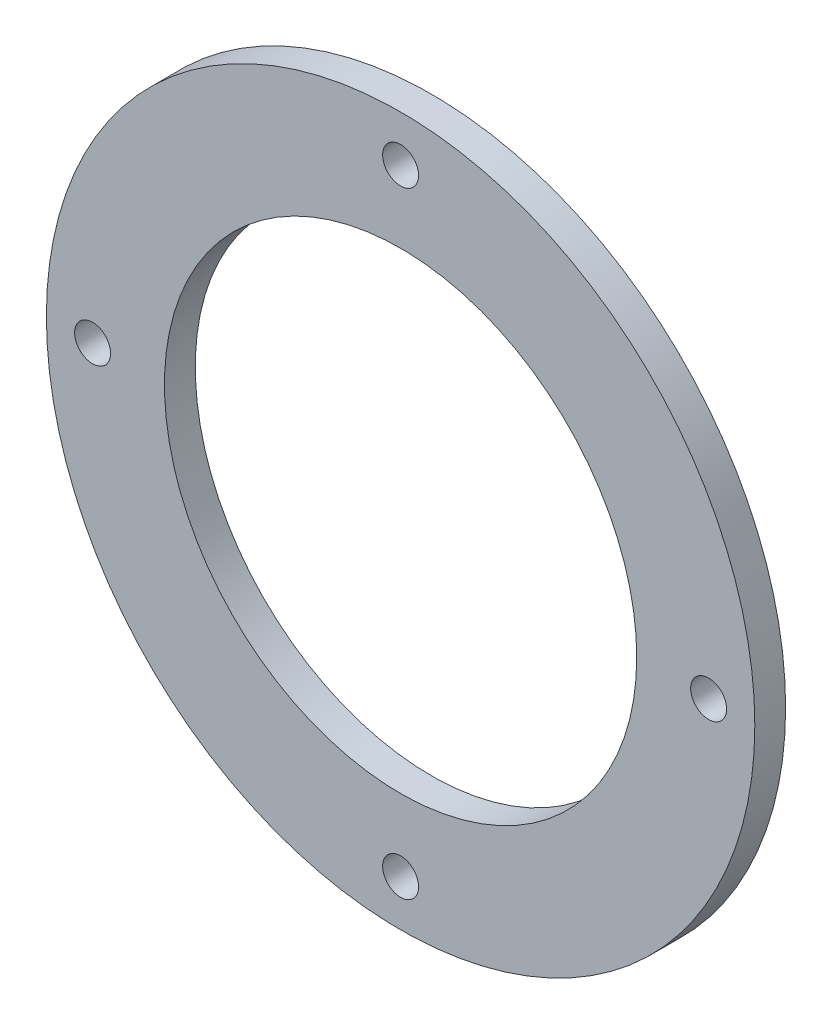
from build123d import *

# Parameters (mm, degrees)
SKETCH1_R           = 34.5
SKETCH1_R_2         = 23
SKETCH1_R_3         = 1.75
BOSS_EXTRUDE1_DEPTH = 3


with BuildPart() as part:
    # Sketch1 → Boss-Extrude1 (new body)
    with BuildSketch(Plane.XY):
        Circle(SKETCH1_R)
        Circle(SKETCH1_R_2, mode=Mode.SUBTRACT)
        with Locations((0, 30)):
            Circle(SKETCH1_R_3, mode=Mode.SUBTRACT)
        with Locations((30, 0)):
            Circle(SKETCH1_R_3, mode=Mode.SUBTRACT)
        with Locations((0, -30)):
            Circle(SKETCH1_R_3, mode=Mode.SUBTRACT)
        with Locations((-30, 0)):
            Circle(SKETCH1_R_3, mode=Mode.SUBTRACT)
    extrude(amount=BOSS_EXTRUDE1_DEPTH)


solid = part.part
